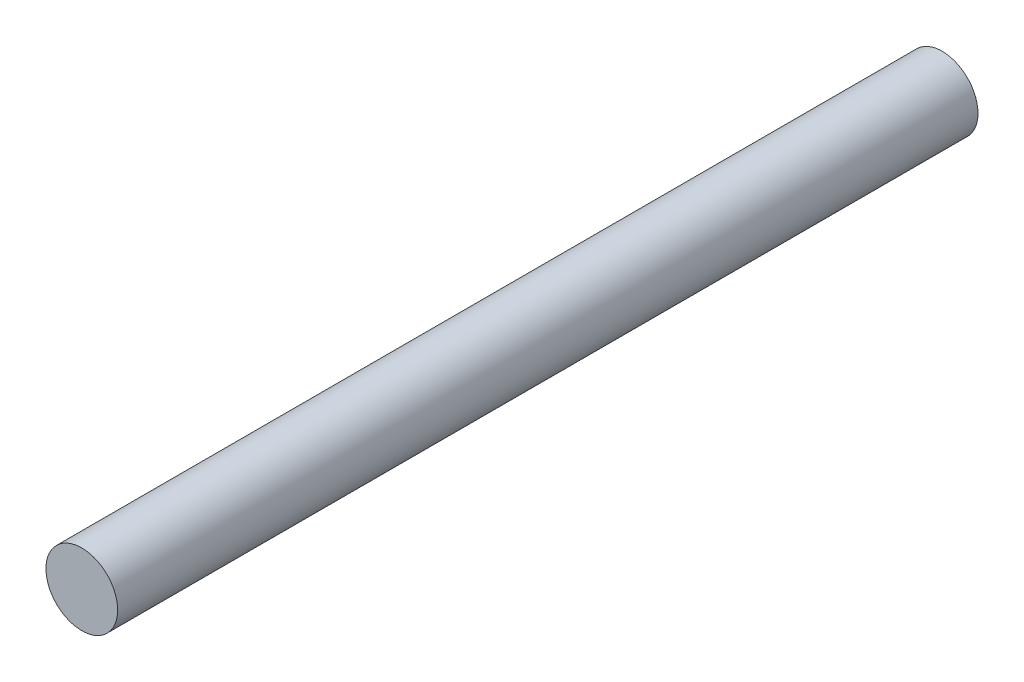
from build123d import *

# Parameters (mm, degrees)
ESBO_O1_R                = 250
RESSALTO_EXTRUS_O1_DEPTH = 6000


with BuildPart() as part:
    # Esboço1 → Ressalto-extrusão1 (new body)
    with BuildSketch(Plane.XY):
        Circle(ESBO_O1_R)
    extrude(amount=RESSALTO_EXTRUS_O1_DEPTH)


solid = part.part
